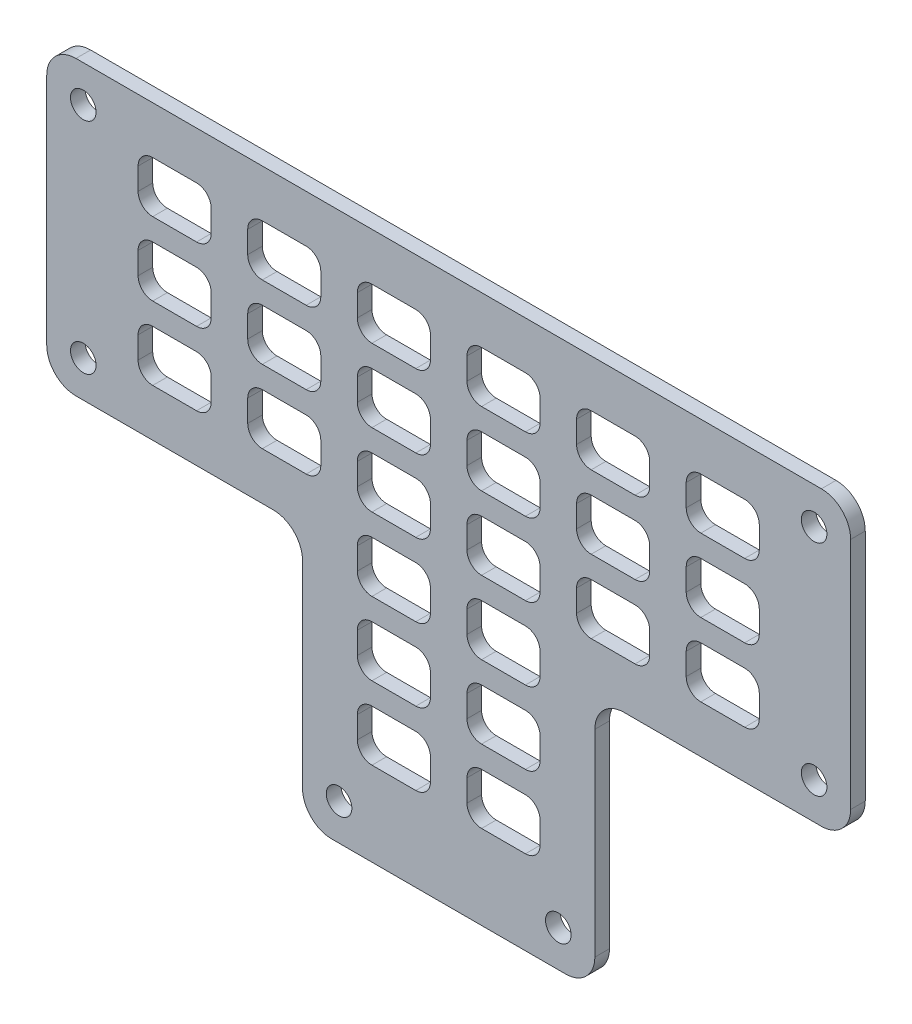
from build123d import *

# Parameters (mm, degrees)
BOSS_EXTRUDE1_DEPTH  = 2
FILLET1_R            = 4
SKETCH2_R            = 1.75
CUT_EXTRUDE1_DEPTH   = 78.807454656
CUT_EXTRUDE2_DEPTH   = 78.807454656
LPATTERN1_COUNT      = 6
LPATTERN1_PITCH      = 15
LPATTERN1_COUNT_DIR2 = 3
LPATTERN1_PITCH_DIR2 = 10
CUT_EXTRUDE3_DEPTH   = 78.807454656


with BuildPart() as part:
    # Sketch1 → Boss-Extrude1 (new body)
    with BuildSketch(Plane.XY):
        Polygon((-20, -55), (-20, -20), (-55, -20), (-55, 20), (55, 20), (55, -20), (20, -20), (20, -55), align=None)
    extrude(amount=BOSS_EXTRUDE1_DEPTH)

    # Fillet1
    fillet1_edges = [part.edges().sort_by_distance(p)[0] for p in [
        (20, -20, 1),
        (20, -55, 1),
        (-20, -55, 1),
        (-20, -20, 1),
        (-55, -20, 1),
        (-55, 20, 1),
        (55, 20, 1),
        (55, -20, 1),
    ]]
    fillet(fillet1_edges, radius=FILLET1_R)

    # Sketch2 → Cut-Extrude1 (cut, through all)
    with BuildSketch(Plane.XY.offset(2)):
        with Locations((-50, 15)):
            Circle(SKETCH2_R)
        with Locations((-50, -15)):
            Circle(SKETCH2_R)
        with Locations((-15, -50)):
            Circle(SKETCH2_R)
        with Locations((15, -50)):
            Circle(SKETCH2_R)
        with Locations((50, -15)):
            Circle(SKETCH2_R)
        with Locations((50, 15)):
            Circle(SKETCH2_R)
    extrude(amount=-CUT_EXTRUDE1_DEPTH, mode=Mode.SUBTRACT)

    # Sketch3 → Cut-Extrude2 (cut, through all)
    with BuildSketch(Plane.XY.offset(2)):
        with BuildLine():
            Line((-40.5, 13.5), (-34.5, 13.5))
            ThreePointArc((-34.5, 13.5), (-33.085786438, 12.914213562), (-32.5, 11.5))
            Line((-32.5, 11.5), (-32.5, 8.5))
            ThreePointArc((-32.5, 8.5), (-33.085786438, 7.085786438), (-34.5, 6.5))
            Line((-34.5, 6.5), (-40.5, 6.5))
            ThreePointArc((-40.5, 6.5), (-41.914213562, 7.085786438), (-42.5, 8.5))
            Line((-42.5, 8.5), (-42.5, 11.5))
            ThreePointArc((-42.5, 11.5), (-41.914213562, 12.914213562), (-40.5, 13.5))
        make_face()
    cut_extrude2 = extrude(amount=-CUT_EXTRUDE2_DEPTH, mode=Mode.SUBTRACT)

    # LPattern1: Cut-Extrude2 6 × 3
    with Locations(*[(i * LPATTERN1_PITCH, -j * LPATTERN1_PITCH_DIR2, 0) for i in range(LPATTERN1_COUNT) for j in range(LPATTERN1_COUNT_DIR2) if (i, j) != (0, 0)]):
        add(cut_extrude2, mode=Mode.SUBTRACT)

    # Sketch4 → Cut-Extrude3 (cut, through all)
    with BuildSketch(Plane.XY.offset(2)):
        with BuildLine():
            Line((2.5, -18.5), (2.5, -21.5))
            ThreePointArc((2.5, -21.5), (3.085786438, -22.914213562), (4.5, -23.5))
            Line((4.5, -23.5), (10.5, -23.5))
            ThreePointArc((10.5, -23.5), (11.914213562, -22.914213562), (12.5, -21.5))
            Line((12.5, -21.5), (12.5, -18.5))
            ThreePointArc((12.5, -18.5), (11.914213562, -17.085786438), (10.5, -16.5))
            Line((10.5, -16.5), (4.5, -16.5))
            ThreePointArc((4.5, -16.5), (3.085786438, -17.085786438), (2.5, -18.5))
        make_face()
        with BuildLine():
            Line((2.5, -28.5), (2.5, -31.5))
            ThreePointArc((2.5, -31.5), (3.085786438, -32.914213562), (4.5, -33.5))
            Line((4.5, -33.5), (10.5, -33.5))
            ThreePointArc((10.5, -33.5), (11.914213562, -32.914213562), (12.5, -31.5))
            Line((12.5, -31.5), (12.5, -28.5))
            ThreePointArc((12.5, -28.5), (11.914213562, -27.085786438), (10.5, -26.5))
            Line((10.5, -26.5), (4.5, -26.5))
            ThreePointArc((4.5, -26.5), (3.085786438, -27.085786438), (2.5, -28.5))
        make_face()
        with BuildLine():
            Line((2.5, -38.5), (2.5, -41.5))
            ThreePointArc((2.5, -41.5), (3.085786438, -42.914213562), (4.5, -43.5))
            Line((4.5, -43.5), (10.5, -43.5))
            ThreePointArc((10.5, -43.5), (11.914213562, -42.914213562), (12.5, -41.5))
            Line((12.5, -41.5), (12.5, -38.5))
            ThreePointArc((12.5, -38.5), (11.914213562, -37.085786438), (10.5, -36.5))
            Line((10.5, -36.5), (4.5, -36.5))
            ThreePointArc((4.5, -36.5), (3.085786438, -37.085786438), (2.5, -38.5))
        make_face()
        with BuildLine():
            Line((-12.5, -18.5), (-12.5, -21.5))
            ThreePointArc((-12.5, -21.5), (-11.914213562, -22.914213562), (-10.5, -23.5))
            Line((-10.5, -23.5), (-4.5, -23.5))
            ThreePointArc((-4.5, -23.5), (-3.085786438, -22.914213562), (-2.5, -21.5))
            Line((-2.5, -21.5), (-2.5, -18.5))
            ThreePointArc((-2.5, -18.5), (-3.085786438, -17.085786438), (-4.5, -16.5))
            Line((-4.5, -16.5), (-10.5, -16.5))
            ThreePointArc((-10.5, -16.5), (-11.914213562, -17.085786438), (-12.5, -18.5))
        make_face()
        with BuildLine():
            Line((-12.5, -28.5), (-12.5, -31.5))
            ThreePointArc((-12.5, -31.5), (-11.914213562, -32.914213562), (-10.5, -33.5))
            Line((-10.5, -33.5), (-4.5, -33.5))
            ThreePointArc((-4.5, -33.5), (-3.085786438, -32.914213562), (-2.5, -31.5))
            Line((-2.5, -31.5), (-2.5, -28.5))
            ThreePointArc((-2.5, -28.5), (-3.085786438, -27.085786438), (-4.5, -26.5))
            Line((-4.5, -26.5), (-10.5, -26.5))
            ThreePointArc((-10.5, -26.5), (-11.914213562, -27.085786438), (-12.5, -28.5))
        make_face()
        with BuildLine():
            Line((-12.5, -38.5), (-12.5, -41.5))
            ThreePointArc((-12.5, -41.5), (-11.914213562, -42.914213562), (-10.5, -43.5))
            Line((-10.5, -43.5), (-4.5, -43.5))
            ThreePointArc((-4.5, -43.5), (-3.085786438, -42.914213562), (-2.5, -41.5))
            Line((-2.5, -41.5), (-2.5, -38.5))
            ThreePointArc((-2.5, -38.5), (-3.085786438, -37.085786438), (-4.5, -36.5))
            Line((-4.5, -36.5), (-10.5, -36.5))
            ThreePointArc((-10.5, -36.5), (-11.914213562, -37.085786438), (-12.5, -38.5))
        make_face()
    extrude(amount=-CUT_EXTRUDE3_DEPTH, mode=Mode.SUBTRACT)


solid = part.part
